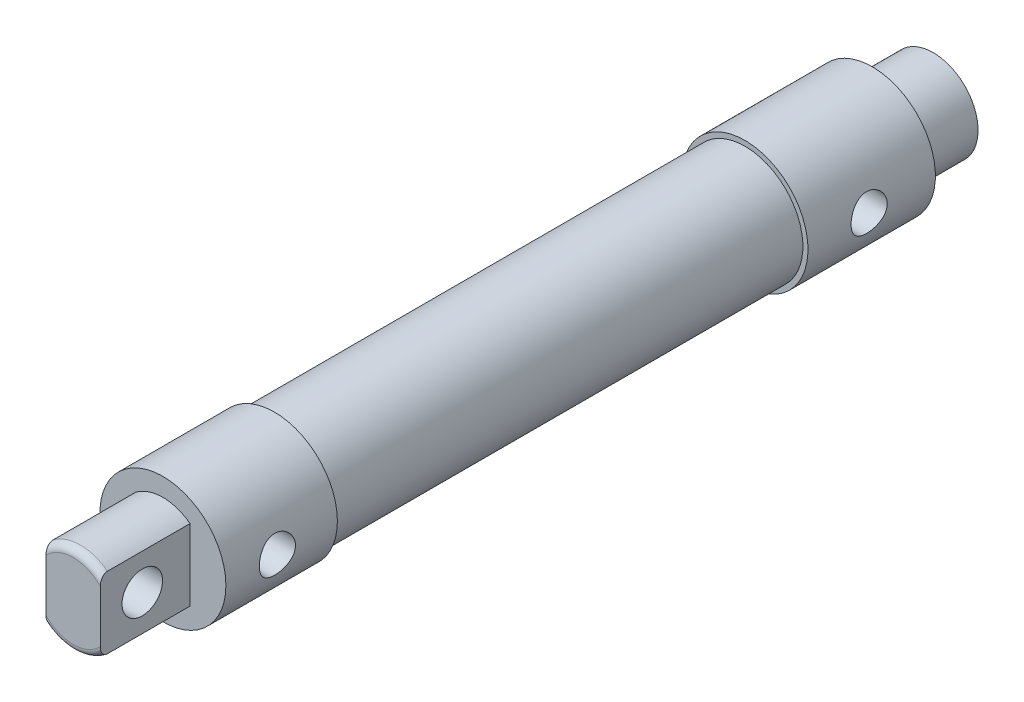
from build123d import *

# Parameters (mm, degrees)
SKETCH1_R               = 10.16
BOSS_EXTRUDE1_DEPTH     = 82.55
SKETCH2_R               = 11.049
BOSS_EXTRUDE2_DEPTH     = 19.558
BOSS_EXTRUDE3_DEPTH     = 15.748
SKETCH4_R               = 3.556
CUT_EXTRUDE1_DEPTH      = 9.525
FILLET1_R               = 1.27
SKETCH5_R               = 11.049
BOSS_EXTRUDE4_DEPTH     = 22.352
SKETCH6_R               = 7.874
BOSS_EXTRUDE5_DEPTH     = 10.668
SKETCH7_R               = 3.175
CUT_EXTRUDE2_DEPTH      = 124.968
CUT_EXTRUDE3_REACH      = 120.887
CUT_EXTRUDE3_END_RADIUS = 11.049
SKETCH8_R               = 3.175


with BuildPart() as part:
    # Sketch1 → Boss-Extrude1 (new body)
    with BuildSketch(Plane.XY):
        Circle(SKETCH1_R)
    extrude(amount=BOSS_EXTRUDE1_DEPTH)

    # Sketch5 → Boss-Extrude4 (add)
    with BuildSketch(Plane(origin=(0, 0, 0), x_dir=(-1, 0, 0), z_dir=(0, 0, -1))):
        with Locations(Location((0, 0, 0), (0, 0, 180))):
            Circle(SKETCH5_R)
    extrude(amount=BOSS_EXTRUDE4_DEPTH)

    # Sketch6 → Boss-Extrude5 (add)
    with BuildSketch(Plane(origin=(0, 0, -22.352), x_dir=(-1, 0, 0), z_dir=(0, 0, -1))):
        Circle(SKETCH6_R)
    extrude(amount=BOSS_EXTRUDE5_DEPTH)


with BuildPart() as body_2:
    # Sketch2 → Boss-Extrude2 (new body)
    with BuildSketch(Plane.XY.offset(82.55)):
        Circle(SKETCH2_R)
    extrude(amount=BOSS_EXTRUDE2_DEPTH)

    # Sketch3 → Boss-Extrude3 (add)
    with BuildSketch(Plane.XY.offset(102.108)):
        with BuildLine():
            Line((4.7625, -6.270444143), (4.7625, 6.270444143))
            ThreePointArc((4.7625, 6.270444143), (0, 7.874), (-4.7625, 6.270444143))
            Line((-4.7625, 6.270444143), (-4.7625, -6.270444143))
            ThreePointArc((-4.7625, -6.270444143), (0, -7.874), (4.7625, -6.270444143))
        make_face()
    extrude(amount=BOSS_EXTRUDE3_DEPTH)

    # Sketch4 → Cut-Extrude1 (cut)
    with BuildSketch(Plane(origin=(4.7625, 0, 0), x_dir=(0, 0, -1), z_dir=(1, 0, 0))):
        with Locations((-110.49, 0)):
            Circle(SKETCH4_R)
    extrude(amount=-CUT_EXTRUDE1_DEPTH, mode=Mode.SUBTRACT)

    # Fillet1
    fillet1_edges = [body_2.edges().sort_by_distance(p)[0] for p in [
        (0, 7.874, 117.856),
        (0, -7.874, 117.856),
    ]]
    fillet(fillet1_edges, radius=FILLET1_R)


with BuildPart() as cut_extrude2_tool:
    # Sketch7 → Cut-Extrude2 (new body)
    with BuildSketch(Plane(origin=(0, 0, -33.02), x_dir=(-1, 0, 0), z_dir=(0, 0, -1))):
        Circle(SKETCH7_R)
    extrude(amount=-CUT_EXTRUDE2_DEPTH)


with BuildPart() as part_1:
    add(part.part)

    # Cut-Extrude2: cut by cut_extrude2_tool
    add(cut_extrude2_tool.part, mode=Mode.SUBTRACT)


with BuildPart() as body_2_1:
    add(body_2.part)

    # Cut-Extrude2: cut by cut_extrude2_tool
    add(cut_extrude2_tool.part, mode=Mode.SUBTRACT)


with BuildPart() as cut_extrude3_tool:
    # Cut-Extrude3: up to this cylinder (the profile starts inside it)
    cut_extrude3_end = Plane(origin=(0, 0, 41.16814), z_dir=(0, 0, -1)) * Cylinder(CUT_EXTRUDE3_END_RADIUS, 368.687876, mode=Mode.PRIVATE)
    # Sketch8 → Cut-Extrude3 (new, up to the surface)
    with BuildSketch(Plane(origin=(0, 0, 0), x_dir=(0, 0, -1), z_dir=(1, 0, 0)), mode=Mode.PRIVATE) as cut_extrude3_sk1:
        with Locations(Location((-93.076077846, 0, 0), (0, 0, 270))):
            Circle(SKETCH8_R)
    cut_extrude3_tool1 = extrude(cut_extrude3_sk1.sketch, amount=CUT_EXTRUDE3_REACH, mode=Mode.PRIVATE) & cut_extrude3_end
    add(cut_extrude3_tool1.solids().sort_by_distance((0, 0, 93.076078))[0])
    # Sketch8 → Cut-Extrude3 (new, up to the surface)
    with BuildSketch(Plane(origin=(0, 0, 0), x_dir=(0, 0, -1), z_dir=(1, 0, 0)), mode=Mode.PRIVATE) as cut_extrude3_sk2:
        with Locations(Location((10.739797543, 0, 0), (0, 0, 270))):
            Circle(SKETCH8_R)
    cut_extrude3_tool2 = extrude(cut_extrude3_sk2.sketch, amount=CUT_EXTRUDE3_REACH, mode=Mode.PRIVATE) & cut_extrude3_end
    add(cut_extrude3_tool2.solids().sort_by_distance((0, 0, -10.739798))[0])


with BuildPart() as part_2:
    add(part_1.part)

    # Cut-Extrude3: cut by cut_extrude3_tool
    add(cut_extrude3_tool.part, mode=Mode.SUBTRACT)


with BuildPart() as body_2_2:
    add(body_2_1.part)

    # Cut-Extrude3: cut by cut_extrude3_tool
    add(cut_extrude3_tool.part, mode=Mode.SUBTRACT)


solid = Compound([part_2.part, body_2_2.part])
